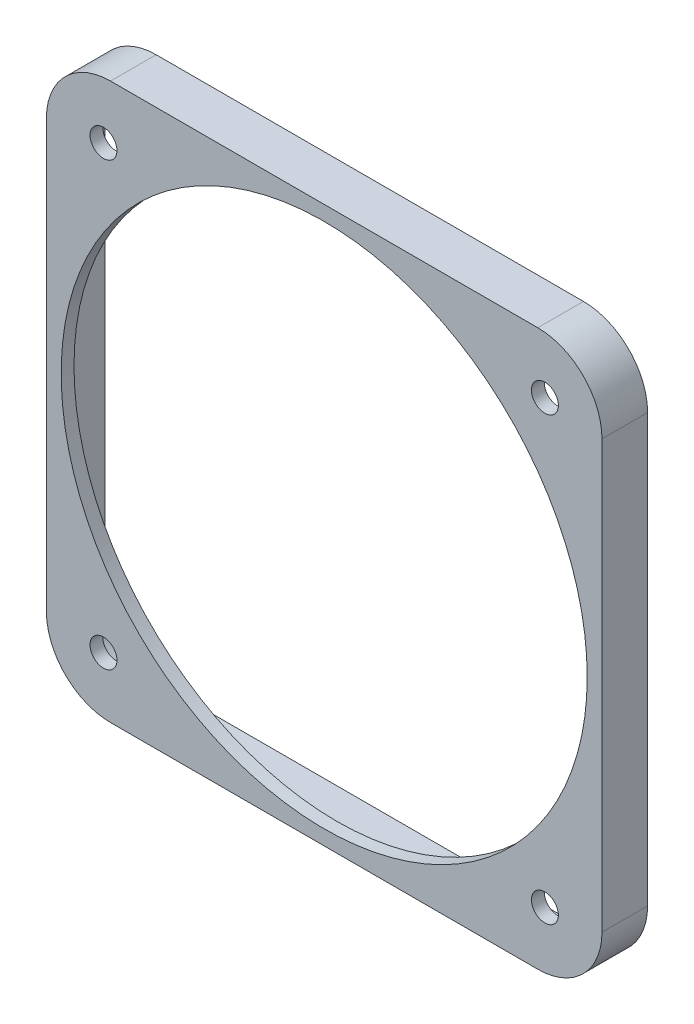
from build123d import *

# Parameters (mm, degrees)
SKETCH1_W           = 109.982
SKETCH1_H           = 109.982
BOSS_EXTRUDE1_DEPTH = 9.0297
FILLET1_R           = 12.7
SHELL1_T            = -2.54
SKETCH2_R           = 52.07
SKETCH2_R_2         = 2.667
CUT_EXTRUDE1_DEPTH  = 79.291478745


with BuildPart() as part:
    # Sketch1 → Boss-Extrude1 (new body)
    with BuildSketch(Plane.XY):
        Rectangle(SKETCH1_W, SKETCH1_H)
    extrude(amount=BOSS_EXTRUDE1_DEPTH)

    # Fillet1
    fillet1_edges = [part.edges().sort_by_distance(p)[0] for p in [
        (54.991, -54.991, 4.51485),
        (-54.991, -54.991, 4.51485),
        (-54.991, 54.991, 4.51485),
        (54.991, 54.991, 4.51485),
    ]]
    fillet(fillet1_edges, radius=FILLET1_R)

    # Shell1
    shell1_openings = [part.faces().sort_by_distance(p)[0] for p in [
        (0, 0, 0),
    ]]
    offset(amount=SHELL1_T, openings=shell1_openings, kind=Kind.INTERSECTION)

    # Sketch2 → Cut-Extrude1 (cut, through all)
    with BuildSketch(Plane.XY.offset(9.0297)):
        Circle(SKETCH2_R)
        with Locations((43.688, 43.688)):
            Circle(SKETCH2_R_2)
        with Locations((-43.688, 43.688)):
            Circle(SKETCH2_R_2)
        with Locations((-43.688, -43.688)):
            Circle(SKETCH2_R_2)
        with Locations((43.688, -43.688)):
            Circle(SKETCH2_R_2)
    extrude(amount=-CUT_EXTRUDE1_DEPTH, mode=Mode.SUBTRACT)


solid = part.part
